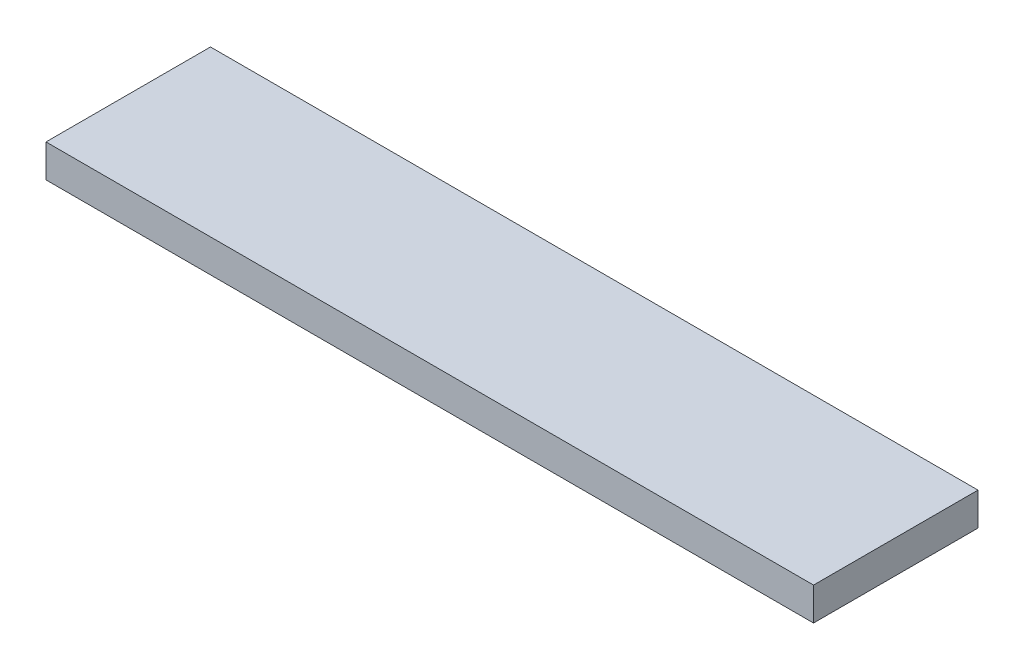
from build123d import *

# Parameters (mm, degrees)
SKETCH1_W           = 350
SKETCH1_H           = 75
BOSS_EXTRUDE1_DEPTH = 15


with BuildPart() as part:
    # Sketch1 → Boss-Extrude1 (new body)
    with BuildSketch(Plane(origin=(0, 0, 0), x_dir=(1, 0, 0), z_dir=(0, 1, 0))):
        Rectangle(SKETCH1_W, SKETCH1_H)
    extrude(amount=BOSS_EXTRUDE1_DEPTH)


solid = part.part
